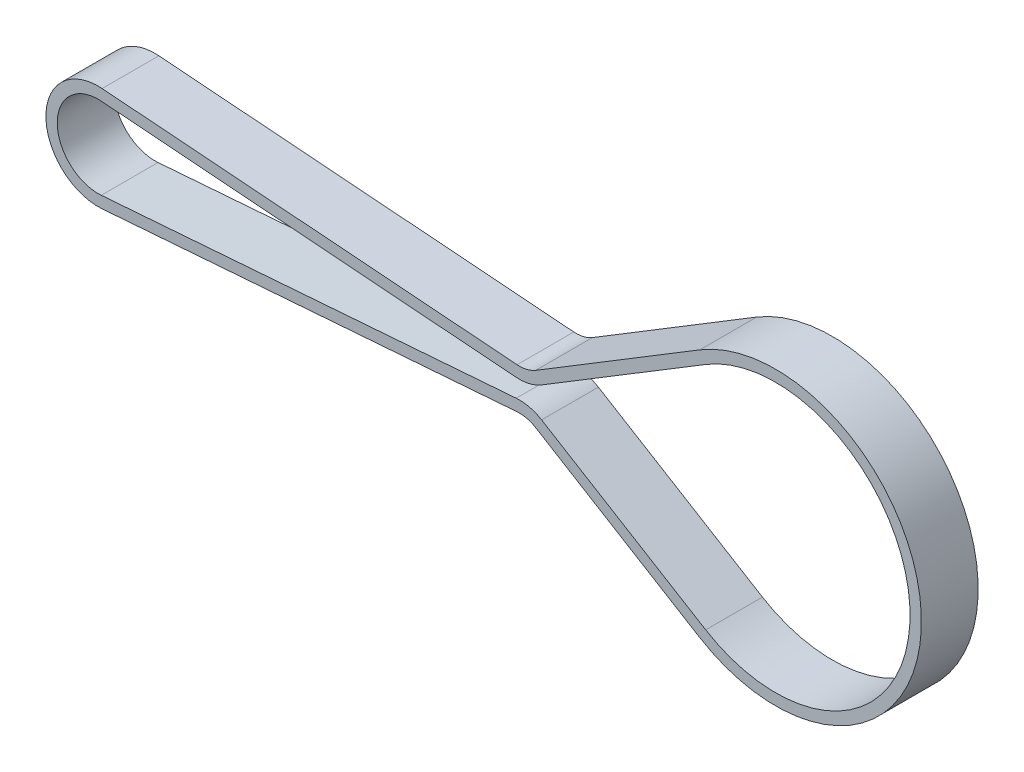
from build123d import *

# Parameters (mm, degrees)
EXTRUDE_THIN1_DEPTH      = 5.5
EXTRUDE_THIN1_DEPTH_BACK = 5.5


with BuildPart() as part:
    # Sketch2 → Extrude-Thin1 (new, two sides: drawn at the far end of the back side and taken through both)
    with BuildSketch(Plane.XY.offset(-EXTRUDE_THIN1_DEPTH_BACK)):
        with BuildLine():
            Line((81.178641226, -3.947665411), (0.77190054, -10.095533396))
            ThreePointArc((0.77190054, -10.095533396), (-10.125, -1.4295e-05), (0.771872034, 10.095535576))
            Line((0.771872034, 10.095535576), (81.178658315, 3.947892472))
            ThreePointArc((81.178658315, 3.947892472), (83.05501584, 4.097128226), (84.795440741, 4.814003411))
            Line((84.795440741, 4.814003411), (116.589341289, 24.149694959))
            ThreePointArc((116.589341289, 24.149694959), (159.541153686, -7.4103e-05), (116.589214662, -24.149617949))
            Line((116.589214662, -24.149617949), (84.795467935, -4.813791582))
            ThreePointArc((84.795467935, -4.813791582), (83.055022982, -4.096901568), (81.178641226, -3.947665411))
        make_face()
        with BuildLine():
            Line((81.010919627, -1.754068031), (0.604178941, -7.901936016))
            ThreePointArc((0.604178941, -7.901936016), (-7.925, -1.1189e-05), (0.604156629, 7.901937722))
            Line((0.604156629, 7.901937722), (81.010942911, 1.754294618))
            ThreePointArc((81.010942911, 1.754294618), (83.567364117, 1.957619113), (85.938585523, 2.934317265))
            Line((85.938585523, 2.934317265), (117.732486072, 22.270008813))
            ThreePointArc((117.732486072, 22.270008813), (157.341153686, -6.8335e-05), (117.7323693, -22.269937798))
            Line((117.7323693, -22.269937798), (85.938622574, -2.93411143))
            ThreePointArc((85.938622574, -2.93411143), (83.567373849, -1.957393076), (81.010919627, -1.754068031))
        make_face(mode=Mode.SUBTRACT)
    extrude(amount=EXTRUDE_THIN1_DEPTH + EXTRUDE_THIN1_DEPTH_BACK)


solid = part.part
